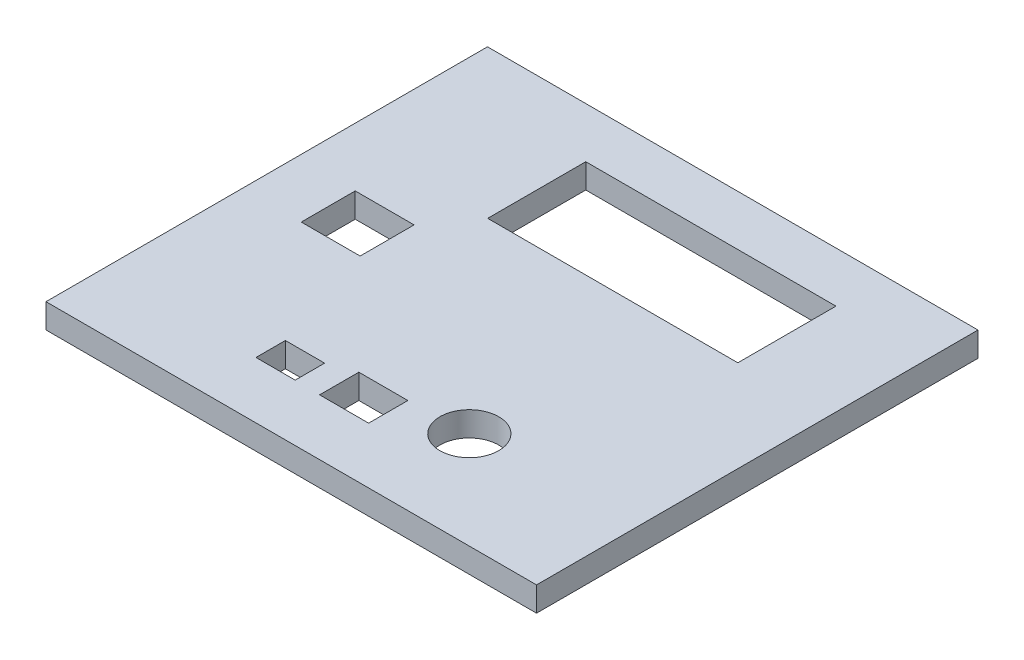
from build123d import *

# Parameters (mm, degrees)
SKETCH1_W           = 100
SKETCH1_H           = 90
BOSS_EXTRUDE2_DEPTH = 5
SKETCH2_R           = 6
SKETCH2_W           = 12
SKETCH2_H           = 11
SKETCH2_W_2         = 51
SKETCH2_H_2         = 20
SKETCH2_W_3         = 10
SKETCH2_H_3         = 8
SKETCH2_W_4         = 8
SKETCH2_H_4         = 6
CUT_EXTRUDE2_DEPTH  = 68.453687816


with BuildPart() as part:
    # Sketch1 → Boss-Extrude2 (new body)
    with BuildSketch(Plane(origin=(0, 0, 0), x_dir=(1, 0, 0), z_dir=(0, 1, 0))):
        Rectangle(SKETCH1_W, SKETCH1_H)
    extrude(amount=BOSS_EXTRUDE2_DEPTH)

    # Sketch2 → Cut-Extrude2 (cut, through all)
    with BuildSketch(Plane(origin=(0, 0, 0), x_dir=(1, 0, 0), z_dir=(0, 1, 0))):
        with Locations(Location((16.455886506, -25.155924864, 0), (0, 0, 270))):
            Circle(SKETCH2_R)
        with Locations((-32.037377006, 0.57672248)):
            Rectangle(SKETCH2_W, SKETCH2_H)
        with Locations((5.806889919, 24.732711273)):
            Rectangle(SKETCH2_W_2, SKETCH2_H_2)
        with Locations((-0.665141256, -29.560577811)):
            Rectangle(SKETCH2_W_3, SKETCH2_H_3)
        with Locations((-14.748919872, -30.448958229)):
            Rectangle(SKETCH2_W_4, SKETCH2_H_4)
    extrude(amount=CUT_EXTRUDE2_DEPTH, mode=Mode.SUBTRACT)


solid = part.part
